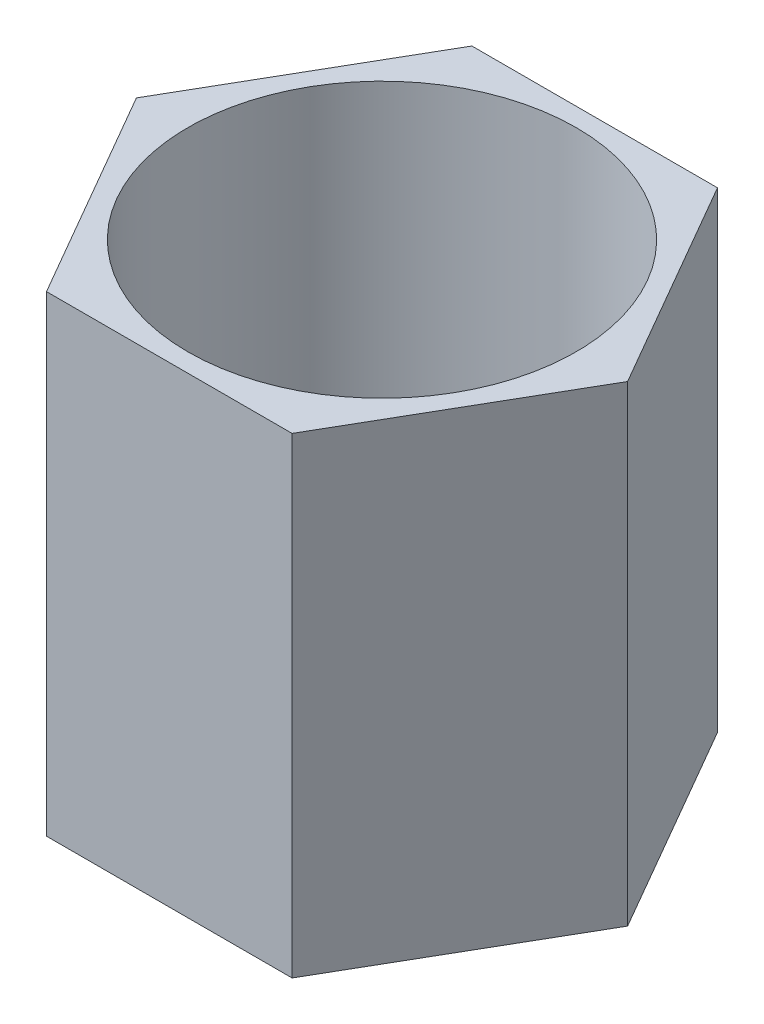
from build123d import *

# Parameters (mm, degrees)
SKETCH1_R           = 3.575
SKETCH1_R_2         = 2.1
BOSS_EXTRUDE1_DEPTH = 5.1
CUT_EXTRUDE1_START  = -10
SKETCH2_R           = 3.575
CUT_EXTRUDE1_DEPTH  = 10


with BuildPart() as part:
    # Sketch1 → Boss-Extrude1 (new body)
    with BuildSketch(Plane(origin=(0, 0, 0), x_dir=(1, 0, 0), z_dir=(0, 1, 0))):
        with Locations(Location((0, 0, 0), (0, 0, 270))):
            Circle(SKETCH1_R)
        with Locations(Location((0, 0, 0), (0, 0, 270))):
            Circle(SKETCH1_R_2, mode=Mode.SUBTRACT)
    extrude(amount=BOSS_EXTRUDE1_DEPTH)

    # Sketch2 → Cut-Extrude1 (cut)
    with BuildSketch(Plane(origin=(0, 5.1, 0), x_dir=(1, 0, 0), z_dir=(0, 1, 0)).offset(CUT_EXTRUDE1_START)):
        Circle(SKETCH2_R)
        Polygon((1.327905619, 2.3), (-1.327905619, 2.3), (-2.655811238, 0), (-1.327905619, -2.3), (1.327905619, -2.3), (2.655811238, 0), align=None, mode=Mode.SUBTRACT)
    extrude(amount=CUT_EXTRUDE1_DEPTH, mode=Mode.SUBTRACT)


solid = part.part
